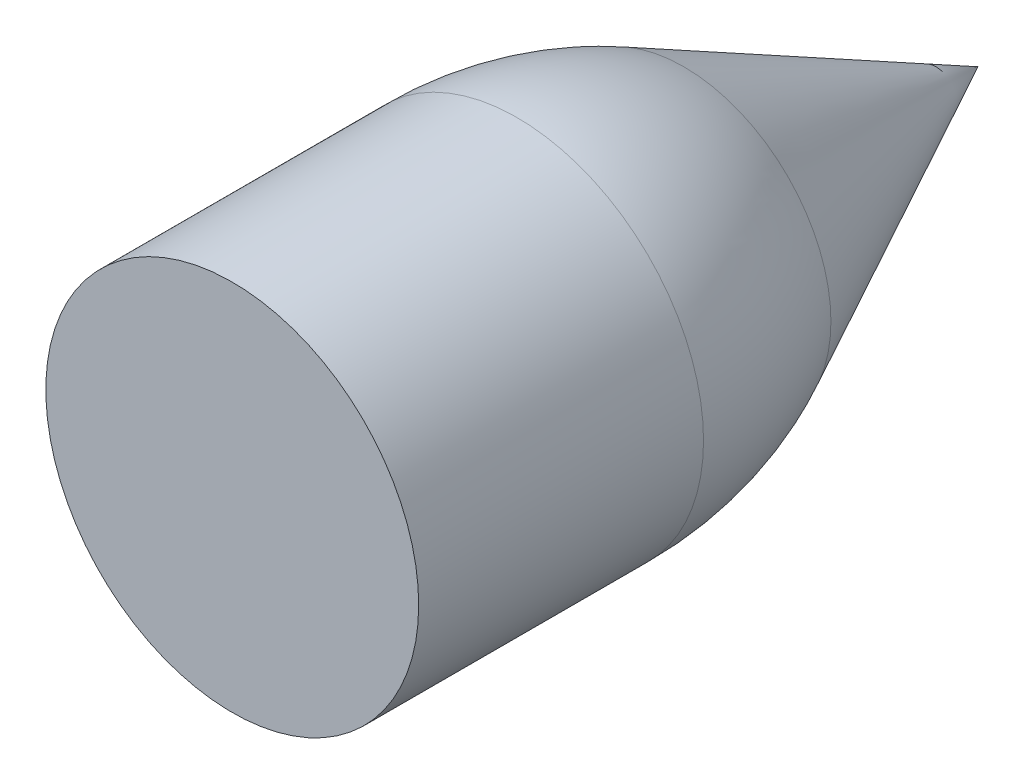
from build123d import *


with BuildPart() as part:
    # Sketch2 → Revolve1 (revolve)
    with BuildSketch(Plane(origin=(0, 0, 0), x_dir=(0, 0, -1), z_dir=(1, 0, 0)), mode=Mode.PRIVATE) as revolve1_sk:
        with BuildLine():
            Line((0, 0), (20, 0))
            Line((20, 0), (12.11145618, -3.94427191))
            ThreePointArc((12.11145618, -3.94427191), (9.93684943, -4.732489895), (7.639320225, -5))
            Line((7.639320225, -5), (0, -5))
            Line((0, -5), (0, 0))
        make_face()
    revolve(revolve1_sk.sketch.rotate(Axis((0, 0, 0), (0, 0, -1)), 270), axis=Axis((0, 0, 0), (0, 0, -1)))


solid = part.part
